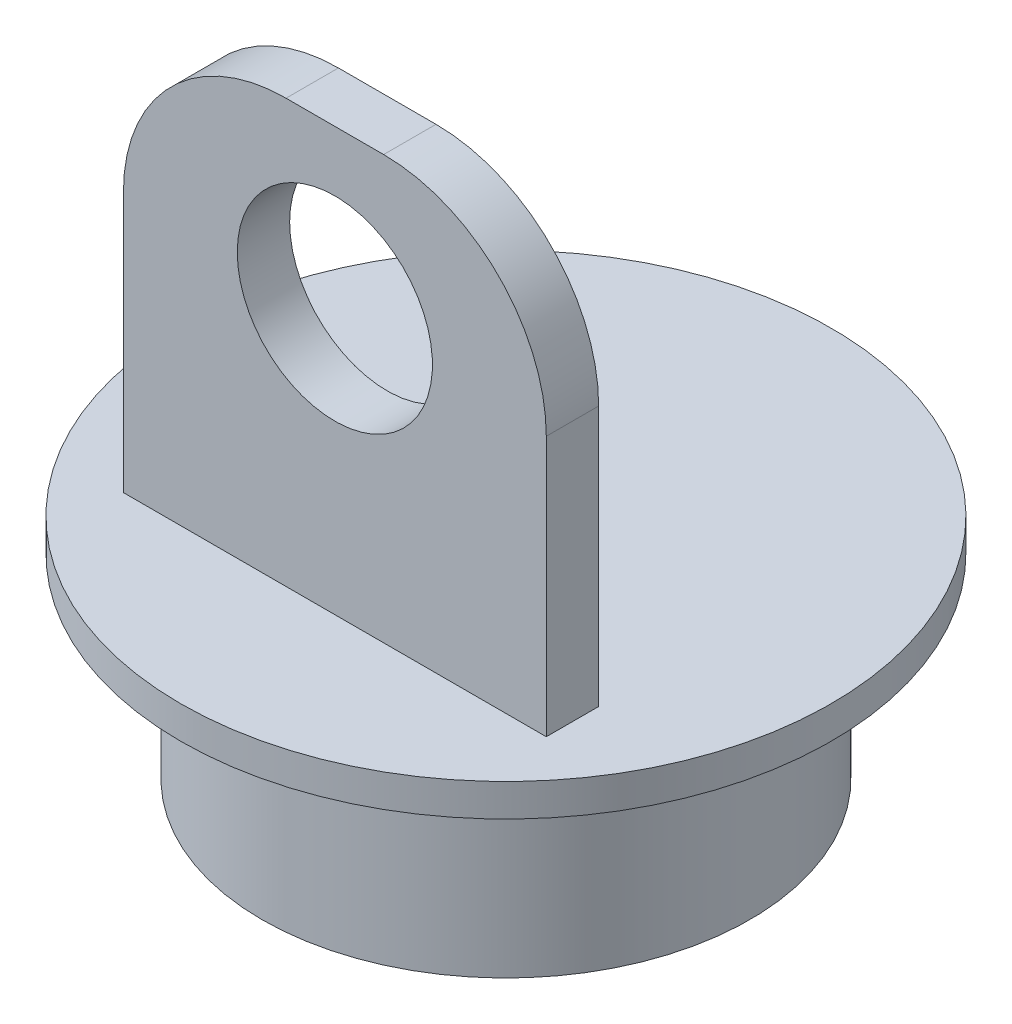
from build123d import *

# Parameters (mm, degrees)
SKETCH3_R           = 37.5
SKETCH3_R_2         = 32.5
BOSS_EXTRUDE1_DEPTH = 30
SKETCH4_R           = 50
BOSS_EXTRUDE2_DEPTH = 5
SKETCH5_W           = 65
SKETCH5_H           = 8.049170271
BOSS_EXTRUDE3_DEPTH = 65
FILLET1_R           = 25
SKETCH6_R           = 15
CUT_EXTRUDE1_DEPTH  = 10


with BuildPart() as part:
    # Sketch3 → Boss-Extrude1 (new body)
    with BuildSketch(Plane(origin=(0, 0, 0), x_dir=(1, 0, 0), z_dir=(0, 1, 0))):
        with Locations(Location((0, 0, 0), (0, 0, 270))):
            Circle(SKETCH3_R)
        with Locations(Location((0, 0, 0), (0, 0, 270))):
            Circle(SKETCH3_R_2, mode=Mode.SUBTRACT)
    extrude(amount=BOSS_EXTRUDE1_DEPTH)

    # Sketch4 → Boss-Extrude2 (add)
    with BuildSketch(Plane(origin=(0, 30, 0), x_dir=(1, 0, 0), z_dir=(0, 1, 0))):
        with Locations(Location((0, 0, 0), (0, 0, 270))):
            Circle(SKETCH4_R)
    extrude(amount=BOSS_EXTRUDE2_DEPTH)

    # Sketch5 → Boss-Extrude3 (add)
    with BuildSketch(Plane(origin=(0, 35, 0), x_dir=(1, 0, 0), z_dir=(0, 1, 0))):
        with Locations((0, -22.269371084)):
            Rectangle(SKETCH5_W, SKETCH5_H)
    extrude(amount=BOSS_EXTRUDE3_DEPTH)

    # Fillet1
    fillet1_edges = [part.edges().sort_by_distance(p)[0] for p in [
        (-32.5, 100, 22.269371084),
        (32.5, 100, 22.269371084),
    ]]
    fillet(fillet1_edges, radius=FILLET1_R)

    # Sketch6 → Cut-Extrude1 (cut)
    with BuildSketch(Plane(origin=(0, 0, 18.244785948), x_dir=(-1, 0, 0), z_dir=(0, 0, -1))):
        with Locations((0, 75.757344868)):
            Circle(SKETCH6_R)
    extrude(amount=-CUT_EXTRUDE1_DEPTH, mode=Mode.SUBTRACT)


solid = part.part
